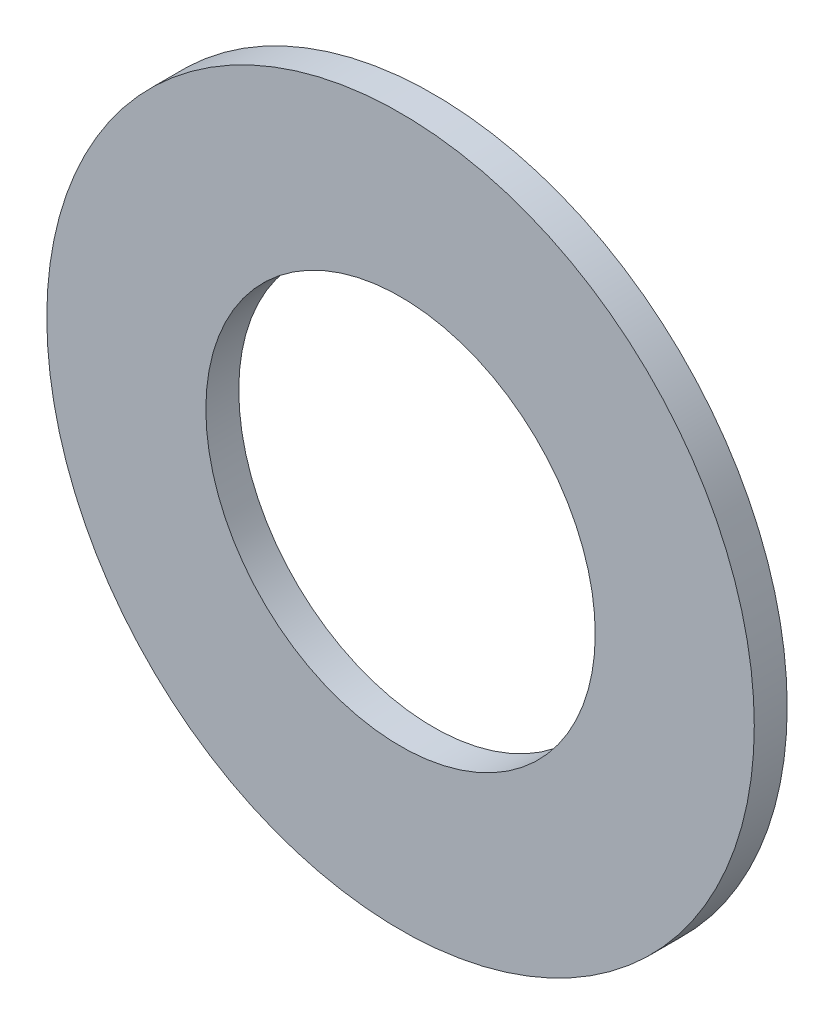
from build123d import *

# Parameters (mm, degrees)
SKETCH2_R           = 32.25
BOSS_EXTRUDE1_DEPTH = 3
SKETCH3_R           = 17.75
CUT_EXTRUDE1_DEPTH  = 3


with BuildPart() as part:
    # Sketch2 → Boss-Extrude1 (new body)
    with BuildSketch(Plane.XY):
        Circle(SKETCH2_R)
    extrude(amount=BOSS_EXTRUDE1_DEPTH)

    # Sketch3 → Cut-Extrude1 (cut)
    with BuildSketch(Plane(origin=(0, 0, 0), x_dir=(-1, 0, 0), z_dir=(0, 0, -1))):
        Circle(SKETCH3_R)
    extrude(amount=-CUT_EXTRUDE1_DEPTH, mode=Mode.SUBTRACT)


solid = part.part
